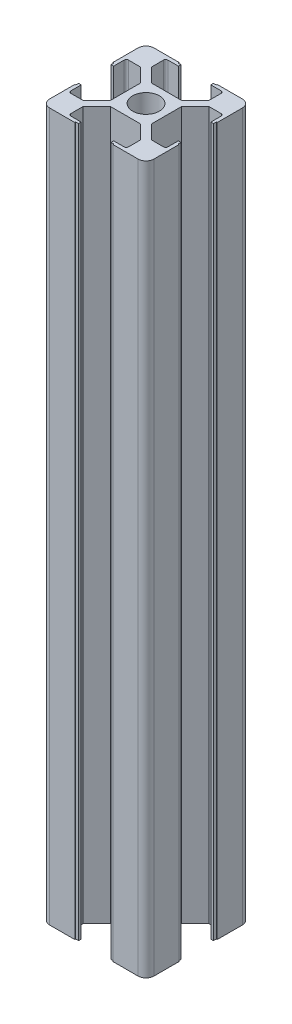
from build123d import *

# Parameters (mm, degrees)
SKETCH_1_W                  = 19.873537876
SKETCH_1_H                  = 135
EXTRUDE_1_DEPTH             = 19.873537875
CUT_EXTRUDE_1_DEPTH         = 136.729432158
CUT_EXTRUDE_2_DEPTH         = 135
CUT_EXTRUDE_3_DEPTH         = 136.729432158
CUT_EXTRUDE_4_DEPTH         = 136.729432158
HOLE_WIZARD_5_0_5_1_D       = 5
HOLE_WIZARD_5_0_5_2_D       = 5
HOLE_WIZARD_5_0_5_3_D       = 5
HOLE_WIZARD_5_0_5_3_DEPTH   = 11.7
HOLE_WIZARD_5_0_5_4_D       = 5
HOLE_WIZARD_5_0_5_4_DEPTH   = 11.7
HOLE_WIZARD_5_1_5_1_1_D     = 5.1
HOLE_WIZARD_5_1_5_1_1_DEPTH = 363.804930222
FILLET_1_R                  = 0.4
FILLET_2_R                  = 1.5


with BuildPart() as part:
    # 草图1 → 凸台-拉伸1 (new body)
    with BuildSketch(Plane.XY.offset(9.936768938)):
        with Locations((0, 67.5)):
            Rectangle(SKETCH_1_W, SKETCH_1_H)
    extrude(amount=-EXTRUDE_1_DEPTH)

    # 草图2 → 切除-拉伸1 (cut, through all)
    with BuildSketch(Plane(origin=(0, 135, 0), x_dir=(-1, 0, 0), z_dir=(0, 1, 0))):
        Polygon((-3.65, -9.936768938), (3.65, -9.936768938), (3.65, -9.76), (3.1, -9.76), (3.1, -9.26), (5.5, -9.26), (5.5, -6.56), (2.84, -3.9), (-2.84, -3.9), (-5.5, -6.56), (-5.5, -9.26), (-3.1, -9.26), (-3.1, -9.76), (-3.65, -9.76), align=None)
    extrude(amount=-CUT_EXTRUDE_1_DEPTH, mode=Mode.SUBTRACT)

    # 草图3 → 切除-拉伸2 (cut)
    with BuildSketch(Plane(origin=(0, 135, 0), x_dir=(-1, 0, 0), z_dir=(0, 1, 0))):
        Polygon((-9.936768938, 3.65), (-9.936768938, -3.65), (-9.76, -3.65), (-9.76, -3.1), (-9.26, -3.1), (-9.26, -5.5), (-6.56, -5.5), (-3.9, -2.84), (-3.9, 2.84), (-6.56, 5.5), (-9.26, 5.5), (-9.26, 3.1), (-9.76, 3.1), (-9.76, 3.65), align=None)
    extrude(amount=-CUT_EXTRUDE_2_DEPTH, mode=Mode.SUBTRACT)

    # 草图4 → 切除-拉伸3 (cut, through all)
    with BuildSketch(Plane(origin=(0, 135, 0), x_dir=(-1, 0, 0), z_dir=(0, 1, 0))):
        Polygon((3.65, 9.936768938), (-3.65, 9.936768938), (-3.65, 9.76), (-3.1, 9.76), (-3.1, 9.26), (-5.5, 9.26), (-5.5, 6.56), (-2.84, 3.9), (2.84, 3.9), (5.5, 6.56), (5.5, 9.26), (3.1, 9.26), (3.1, 9.76), (3.65, 9.76), align=None)
    extrude(amount=-CUT_EXTRUDE_3_DEPTH, mode=Mode.SUBTRACT)

    # 草图5 → 切除-拉伸4 (cut, through all)
    with BuildSketch(Plane(origin=(0, 135, 0), x_dir=(-1, 0, 0), z_dir=(0, 1, 0))):
        Polygon((9.936768938, -3.65), (9.936768938, 3.65), (9.76, 3.65), (9.76, 3.1), (9.26, 3.1), (9.26, 5.5), (6.56, 5.5), (3.9, 2.84), (3.9, -2.84), (6.56, -5.5), (9.26, -5.5), (9.26, -3.1), (9.76, -3.1), (9.76, -3.65), align=None)
    extrude(amount=-CUT_EXTRUDE_4_DEPTH, mode=Mode.SUBTRACT)

    # Ø5.0 (5) 直径孔1 (through all)
    with Locations(Plane(origin=(3.9, 0, 0), x_dir=(0, 0, -1), z_dir=(1, 0, 0))):
        with Locations((0, 123)):
            Hole(HOLE_WIZARD_5_0_5_1_D / 2)

    # Ø5.0 (5) 直径孔2 (through all)
    with Locations(Plane(origin=(0, 0, -3.9), x_dir=(-1, 0, 0), z_dir=(0, 0, -1))):
        with Locations((0, 12)):
            Hole(HOLE_WIZARD_5_0_5_2_D / 2)

    # Ø5.0 (5) 直径孔3
    with Locations(Plane.ZY.offset(3.9)):
        with Locations((0, 12)):
            Hole(HOLE_WIZARD_5_0_5_3_D / 2, depth=HOLE_WIZARD_5_0_5_3_DEPTH)

    # Ø5.0 (5) 直径孔4
    with Locations(Plane.XY.offset(3.9)):
        with Locations((0, 123)):
            Hole(HOLE_WIZARD_5_0_5_4_D / 2, depth=HOLE_WIZARD_5_0_5_4_DEPTH)

    # Ø5.1 (5.1) 直径孔1
    with Locations(Plane(origin=(0, 0, 0), x_dir=(-1, 0, 0), z_dir=(0, -1, 0))):
        with Locations((0, 0)):
            Hole(HOLE_WIZARD_5_1_5_1_1_D / 2, depth=HOLE_WIZARD_5_1_5_1_1_DEPTH)

    # 圆角1
    fillet_1_edges = [part.edges().sort_by_distance(p)[0] for p in [
        (-5.5, 67.5, 9.26),
        (5.5, 67.5, 9.26),
        (-9.26, 67.5, -5.5),
        (-9.26, 67.5, 5.5),
        (5.5, 67.5, -9.26),
        (-5.5, 67.5, -9.26),
        (9.26, 67.5, 5.5),
        (9.26, 67.5, -5.5),
    ]]
    fillet(fillet_1_edges, radius=FILLET_1_R)

    # 圆角2
    fillet_2_edges = [part.edges().sort_by_distance(p)[0] for p in [
        (9.936768938, 67.5, -9.936768938),
        (9.936768938, 67.5, 9.936768938),
        (-9.936768938, 67.5, 9.936768938),
        (-9.936768938, 67.5, -9.936768938),
    ]]
    fillet(fillet_2_edges, radius=FILLET_2_R)


solid = part.part
